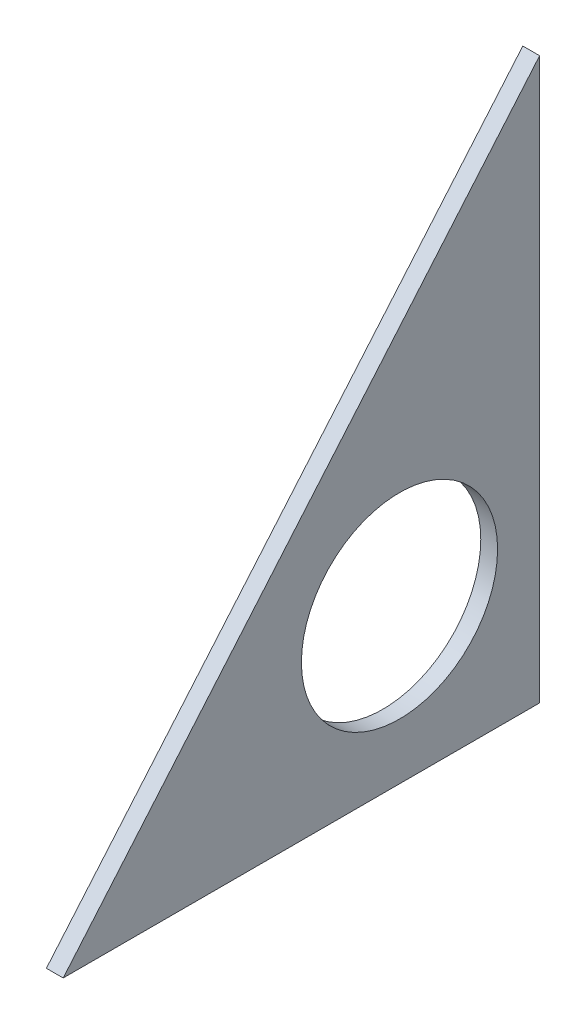
from build123d import *

# Parameters (mm, degrees)
SKETCH1_R           = 35
BOSS_EXTRUDE1_DEPTH = 6


with BuildPart() as part:
    # Sketch1 → Boss-Extrude1 (new body)
    with BuildSketch(Plane(origin=(0, 0, 0), x_dir=(0, 0, -1), z_dir=(1, 0, 0))):
        Polygon((0, 0), (170, 0), (170, 200), align=None)
        with Locations((120, 55)):
            Circle(SKETCH1_R, mode=Mode.SUBTRACT)
    extrude(amount=BOSS_EXTRUDE1_DEPTH)


solid = part.part
